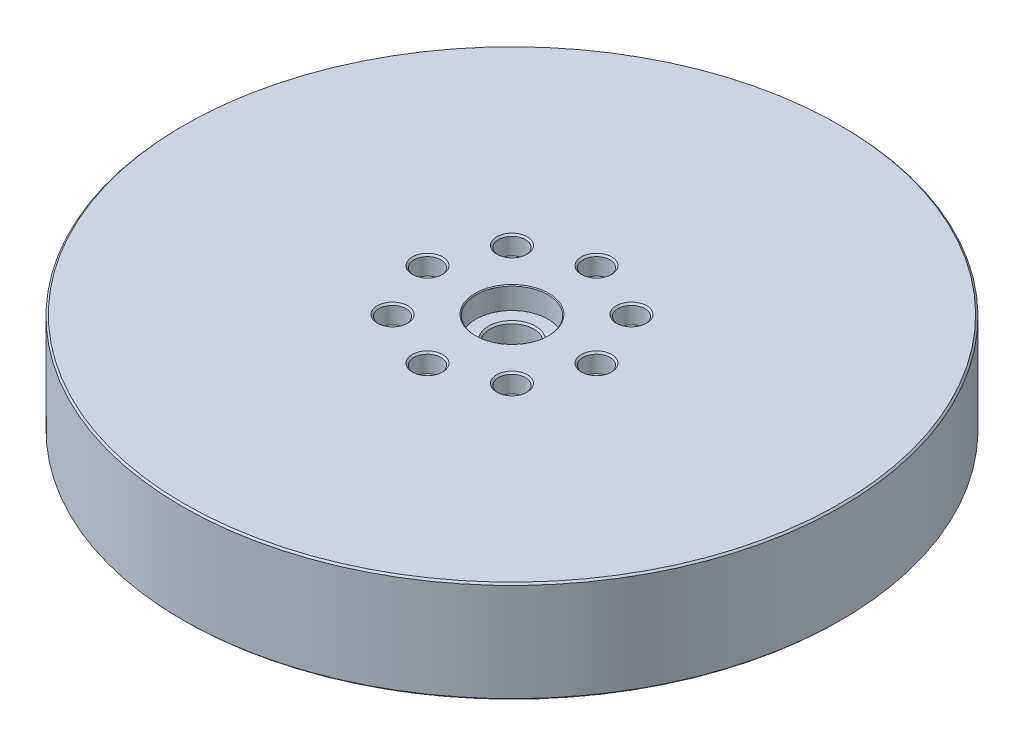
from build123d import *

# Parameters (mm, degrees)
CUT_EXTRUDE1_DEPTH      = 286.527581855
CUT_EXTRUDE1_DEPTH_BACK = 286.527581855
SKETCH2_R               = 4
SKETCH4_R               = 8
CUT_EXTRUDE3_DEPTH      = 12
BOSS_EXTRUDE1_START     = 30
SKETCH5_R               = 74.5
SKETCH5_R_2             = 4
SKETCH5_R_3             = 13
BOSS_EXTRUDE1_DEPTH     = 1
SKETCH6_R               = 74.5
CUT_EXTRUDE4_DEPTH      = 2.5
BOSS_EXTRUDE3_START     = 0.01
SKETCH7_R               = 2.6
BOSS_EXTRUDE3_DEPTH     = 5
SKETCH8_R               = 2.6
BOSS_EXTRUDE4_DEPTH     = 5
CHAMFER3_SIZE           = 3.5
CHAMFER4_SIZE           = 3.5
SKETCH9_R               = 2.6
CUT_EXTRUDE5_DEPTH      = 15
SKETCH10_R              = 65
SKETCH10_R_2            = 35
CUT_EXTRUDE6_DEPTH      = 10
CHAMFER5_SIZE           = 1


with BuildPart() as part:
    # Sketch1 → Revolve1 (revolve)
    with BuildSketch(Plane(origin=(0, 0, 0), x_dir=(0, 0, -1), z_dir=(1, 0, 0))):
        Polygon((-195, 60), (-195, 0), (-185.5, 0), (-185.5, 10), (-74.5, 10), (-74.5, 0), (-74.5, -14), (-15.5, -14), (-13, -11.5), (-13, 47), (-21.25, 47), (-21.25, 59.5), (-21.75, 60), (-74.5, 60), (-185.5, 60), align=None)
    revolve(axis=Axis((0, -14, 0), (0, -1, 0)))

    # Sketch2 → Cut-Extrude1 (cut, two sides: drawn at the far end of the back side and taken through both)
    with BuildSketch(Plane(origin=(0, 60, 0), x_dir=(1, 0, 0), z_dir=(0, 1, 0)).offset(-CUT_EXTRUDE1_DEPTH_BACK)):
        with Locations(Location((-50, 0, 0), (0, 0, 270))):
            Circle(SKETCH2_R)
        with Locations(Location((-35.355339059, 35.355339059, 0), (0, 0, 270))):
            Circle(SKETCH2_R)
        with Locations(Location((0, 50, 0), (0, 0, 270))):
            Circle(SKETCH2_R)
        with Locations(Location((35.355339059, 35.355339059, 0), (0, 0, 270))):
            Circle(SKETCH2_R)
        with Locations(Location((50, 0, 0), (0, 0, 270))):
            Circle(SKETCH2_R)
        with Locations(Location((35.355339059, -35.355339059, 0), (0, 0, 270))):
            Circle(SKETCH2_R)
        with Locations(Location((0, -50, 0), (0, 0, 270))):
            Circle(SKETCH2_R)
        with Locations(Location((-35.355339059, -35.355339059, 0), (0, 0, 270))):
            Circle(SKETCH2_R)
    extrude(amount=CUT_EXTRUDE1_DEPTH + CUT_EXTRUDE1_DEPTH_BACK, mode=Mode.SUBTRACT)

    # Sketch4 → Cut-Extrude3 (cut)
    with BuildSketch(Plane(origin=(0, 60, 0), x_dir=(1, 0, 0), z_dir=(0, 1, 0))):
        with Locations(Location((0, 50, 0), (0, 0, 270))):
            Circle(SKETCH4_R)
        with Locations(Location((35.355339059, 35.355339059, 0), (0, 0, 270))):
            Circle(SKETCH4_R)
        with Locations(Location((50, 0, 0), (0, 0, 270))):
            Circle(SKETCH4_R)
        with Locations(Location((35.355339059, -35.355339059, 0), (0, 0, 270))):
            Circle(SKETCH4_R)
        with Locations(Location((0, -50, 0), (0, 0, 270))):
            Circle(SKETCH4_R)
        with Locations(Location((-35.355339059, -35.355339059, 0), (0, 0, 270))):
            Circle(SKETCH4_R)
        with Locations(Location((-50, 0, 0), (0, 0, 270))):
            Circle(SKETCH4_R)
        with Locations(Location((-35.355339059, 35.355339059, 0), (0, 0, 270))):
            Circle(SKETCH4_R)
    extrude(amount=-CUT_EXTRUDE3_DEPTH, mode=Mode.SUBTRACT)

    # Sketch6 → Cut-Extrude4 (cut)
    with BuildSketch(Plane.XZ.offset(14)):
        with Locations(Location((0, 0, 0), (0, 0, 270))):
            Circle(SKETCH6_R)
    extrude(amount=-CUT_EXTRUDE4_DEPTH, mode=Mode.SUBTRACT)

    # Sketch9 → Cut-Extrude5 (cut)
    with BuildSketch(Plane.XZ.offset(-10)):
        with Locations(Location((0, 157, 0), (0, 0, 270))):
            Circle(SKETCH9_R)
        with Locations(Location((0, 102, 0), (0, 0, 270))):
            Circle(SKETCH9_R)
        with Locations(Location((111.015764646, 111.015764646, 0), (0, 0, 270))):
            Circle(SKETCH9_R)
        with Locations(Location((72.124891681, 72.124891681, 0), (0, 0, 270))):
            Circle(SKETCH9_R)
        with Locations(Location((157, 0, 0), (0, 0, 270))):
            Circle(SKETCH9_R)
        with Locations(Location((102, 0, 0), (0, 0, 270))):
            Circle(SKETCH9_R)
        with Locations(Location((111.015764646, -111.015764646, 0), (0, 0, 270))):
            Circle(SKETCH9_R)
        with Locations(Location((72.124891681, -72.124891681, 0), (0, 0, 270))):
            Circle(SKETCH9_R)
        with Locations(Location((0, -157, 0), (0, 0, 270))):
            Circle(SKETCH9_R)
        with Locations(Location((0, -102, 0), (0, 0, 270))):
            Circle(SKETCH9_R)
        with Locations(Location((-111.015764646, -111.015764646, 0), (0, 0, 270))):
            Circle(SKETCH9_R)
        with Locations(Location((-72.124891681, -72.124891681, 0), (0, 0, 270))):
            Circle(SKETCH9_R)
        with Locations(Location((-157, 0, 0), (0, 0, 270))):
            Circle(SKETCH9_R)
        with Locations(Location((-102, 0, 0), (0, 0, 270))):
            Circle(SKETCH9_R)
        with Locations(Location((-111.015764646, 111.015764646, 0), (0, 0, 270))):
            Circle(SKETCH9_R)
        with Locations(Location((-72.124891681, 72.124891681, 0), (0, 0, 270))):
            Circle(SKETCH9_R)
    extrude(amount=-CUT_EXTRUDE5_DEPTH, mode=Mode.SUBTRACT)

    # Sketch10 → Cut-Extrude6 (cut)
    with BuildSketch(Plane.XZ.offset(11.5)):
        with Locations(Location((0, 0, 0), (0, 0, 270))):
            Circle(SKETCH10_R)
        with Locations(Location((0, 0, 0), (0, 0, 270))):
            Circle(SKETCH10_R_2, mode=Mode.SUBTRACT)
    extrude(amount=-CUT_EXTRUDE6_DEPTH, mode=Mode.SUBTRACT)

    # Chamfer5
    chamfer5_edges = [part.edges().sort_by_distance(p)[0] for p in [
        (50, 60, -8),
        (50, 48, -8),
        (35.355339059, 60, -43.355339059),
        (35.355339059, 48, -43.355339059),
        (0, 60, -58),
        (0, 48, -58),
        (0, 60, -195),
        (0, 0, -195),
        (0, 10, -185.5),
        (0, -11.5, -13),
        (0, -11.5, -74.5),
        (0, 10, -74.5),
        (0, 47, -13),
        (0, -1.5, 35),
        (-35.355339059, -1.5, 31.355339059),
        (0, -1.5, 46),
        (35.355339059, -1.5, 31.355339059),
        (50, -1.5, -4),
        (35.355339059, -1.5, -39.355339059),
        (0, -1.5, -54),
        (-35.355339059, -1.5, -39.355339059),
        (0, -11.5, 65),
        (0, -1.5, 65),
        (-50, -1.5, -4),
        (0, -11.5, 35),
        (-35.355339059, 60, -43.355339059),
        (-35.355339059, 48, -43.355339059),
        (-50, 60, -8),
        (-50, 48, -8),
        (-35.355339059, 60, 27.355339059),
        (-35.355339059, 48, 27.355339059),
        (0, 60, 42),
        (0, 48, 42),
        (35.355339059, 60, 27.355339059),
        (35.355339059, 48, 27.355339059),
    ]]
    chamfer(chamfer5_edges, length=CHAMFER5_SIZE)


with BuildPart() as body_2:
    # Sketch5 → Boss-Extrude1 (new body)
    with BuildSketch(Plane.XZ.offset(14).offset(BOSS_EXTRUDE1_START)):
        with Locations(Location((0, 0, 0), (0, 0, 270))):
            Circle(SKETCH5_R)
        with Locations(Location((35.355339059, -35.355339059, 0), (0, 0, 270))):
            Circle(SKETCH5_R_2, mode=Mode.SUBTRACT)
        with Locations(Location((0, -50, 0), (0, 0, 270))):
            Circle(SKETCH5_R_2, mode=Mode.SUBTRACT)
        with Locations(Location((-35.355339059, -35.355339059, 0), (0, 0, 270))):
            Circle(SKETCH5_R_2, mode=Mode.SUBTRACT)
        with Locations(Location((-50, 0, 0), (0, 0, 270))):
            Circle(SKETCH5_R_2, mode=Mode.SUBTRACT)
        with Locations(Location((50, 0, 0), (0, 0, 270))):
            Circle(SKETCH5_R_2, mode=Mode.SUBTRACT)
        with Locations(Location((35.355339059, 35.355339059, 0), (0, 0, 270))):
            Circle(SKETCH5_R_2, mode=Mode.SUBTRACT)
        with Locations(Location((-35.355339059, 35.355339059, 0), (0, 0, 270))):
            Circle(SKETCH5_R_2, mode=Mode.SUBTRACT)
        with Locations(Location((0, 50, 0), (0, 0, 270))):
            Circle(SKETCH5_R_2, mode=Mode.SUBTRACT)
        with Locations(Location((0, 0, 0), (0, 0, 270))):
            Circle(SKETCH5_R_3, mode=Mode.SUBTRACT)
    extrude(amount=BOSS_EXTRUDE1_DEPTH)


with BuildPart() as body_3:
    # Sketch7 → Boss-Extrude3 (new body)
    with BuildSketch(Plane.XZ.offset(-10).offset(BOSS_EXTRUDE3_START)):
        with BuildLine():
            Line((28.238679848, 69.480766838), (69.951551813, 170.184548062))
            ThreePointArc((69.951551813, 170.184548062), (0, 184), (-69.951551813, 170.184548062))
            Line((-69.951551813, 170.184548062), (-28.238679848, 69.480766838))
            ThreePointArc((-28.238679848, 69.480766838), (0, 75), (28.238679848, 69.480766838))
        make_face()
        with Locations(Location((0, 157, 0), (0, 0, 270))):
            Circle(SKETCH7_R, mode=Mode.SUBTRACT)
        with Locations(Location((0, 102, 0), (0, 0, 90))):
            Circle(SKETCH7_R, mode=Mode.SUBTRACT)
    extrude(amount=BOSS_EXTRUDE3_DEPTH)

    # Chamfer4
    chamfer4_edges = [body_3.edges().sort_by_distance(p)[0] for p in [
        (0, 9.99, 159.6),
        (0, 9.99, 99.4),
    ]]
    chamfer(chamfer4_edges, length=CHAMFER4_SIZE)


with BuildPart() as body_4:
    # Sketch8 → Boss-Extrude4 (new body)
    with BuildSketch(Plane.XZ.offset(-4.99)):
        with BuildLine():
            Line((28.238679848, 69.480766838), (69.951551813, 170.184548062))
            ThreePointArc((69.951551813, 170.184548062), (0, 184), (-69.951551813, 170.184548062))
            Line((-69.951551813, 170.184548062), (-28.238679848, 69.480766838))
            ThreePointArc((-28.238679848, 69.480766838), (0, 75), (28.238679848, 69.480766838))
        make_face()
        with Locations(Location((0, 102, 0), (0, 0, 270))):
            Circle(SKETCH8_R, mode=Mode.SUBTRACT)
        with Locations(Location((0, 157, 0), (0, 0, 270))):
            Circle(SKETCH8_R, mode=Mode.SUBTRACT)
    extrude(amount=BOSS_EXTRUDE4_DEPTH)

    # Chamfer3
    chamfer3_edges = [body_4.edges().sort_by_distance(p)[0] for p in [
        (0, -0.01, 104.6),
        (0, -0.01, 159.6),
    ]]
    chamfer(chamfer3_edges, length=CHAMFER3_SIZE)


solid = Compound([part.part, body_2.part, body_3.part, body_4.part])
